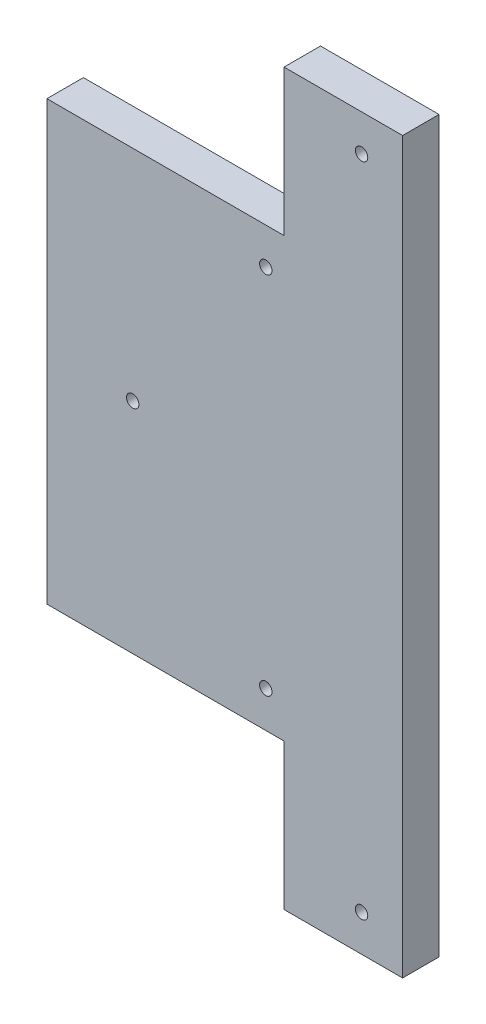
from build123d import *

# Parameters (mm, degrees)
BOSS_EXTRUDE1_DEPTH             = 10
SKETCH4_R                       = 1.7
CUT_EXTRUDE3_DEPTH              = 15
CBORE_FOR_M3_SBHCS1_D           = 3.4
CBORE_FOR_M3_SBHCS1_DEPTH       = 3.15
CBORE_FOR_M3_SBHCS1_CBORE_D     = 6.7
CBORE_FOR_M3_SBHCS1_CBORE_DEPTH = 1.65
CBORE_FOR_M3_SBHCS1_TIP         = 1.021463052
CBORE_FOR_M3_SBHCS2_D           = 3.4
CBORE_FOR_M3_SBHCS2_DEPTH       = 3.15
CBORE_FOR_M3_SBHCS2_CBORE_D     = 6.7
CBORE_FOR_M3_SBHCS2_CBORE_DEPTH = 1.65
CBORE_FOR_M3_SBHCS2_TIP         = 1.021463052
SKETCH7_W                       = 65
SKETCH7_H                       = 120
BOSS_EXTRUDE2_DEPTH             = 10
SKETCH9_W                       = 10
SKETCH9_H                       = 120
BOSS_EXTRUDE3_DEPTH             = 12
SKETCH10_W                      = 65
SKETCH10_H                      = 120
BOSS_EXTRUDE4_DEPTH             = 7
SKETCH11_R                      = 11
BOSS_EXTRUDE5_DEPTH             = 12
SKETCH13_W                      = 65
SKETCH13_H                      = 120
CUT_EXTRUDE4_DEPTH              = 19
SKETCH14_R                      = 1.7
CUT_EXTRUDE5_DEPTH              = 15
CBORE_FOR_M3_SBHCS3_D           = 3.4
CBORE_FOR_M3_SBHCS3_DEPTH       = 3.15
CBORE_FOR_M3_SBHCS3_CBORE_D     = 6.7
CBORE_FOR_M3_SBHCS3_CBORE_DEPTH = 1.65
CBORE_FOR_M3_SBHCS3_TIP         = 1.021463052
SKETCH17_R                      = 1.7
CUT_EXTRUDE6_DEPTH              = 10
CBORE_FOR_M3_SBHCS4_D           = 3.4
CBORE_FOR_M3_SBHCS4_DEPTH       = 3.15
CBORE_FOR_M3_SBHCS4_CBORE_D     = 6.7
CBORE_FOR_M3_SBHCS4_CBORE_DEPTH = 1.65
CBORE_FOR_M3_SBHCS4_TIP         = 1.021463052


with BuildPart() as part:
    # Sketch1 → Boss-Extrude1 (new body)
    with BuildSketch(Plane(origin=(0, 0, 0), x_dir=(0, 1, 0), z_dir=(0, 0, 1))):
        Polygon((-100, 11.25), (-100, 21.25), (100, 21.25), (100, 11.25), (100, -11.25), (-100, -11.25), align=None)
    extrude(amount=BOSS_EXTRUDE1_DEPTH)

    # Sketch4 → Cut-Extrude3 (cut)
    with BuildSketch(Plane.XY.offset(10)):
        with Locations((0, 90)):
            Circle(SKETCH4_R)
        with Locations((0, -90)):
            Circle(SKETCH4_R)
    extrude(amount=-CUT_EXTRUDE3_DEPTH, mode=Mode.SUBTRACT)

    # CBORE for M3 SBHCS1
    with Locations(Plane(origin=(0, 90, 0), x_dir=(-1, 0, 0), z_dir=(0, 0, -1))):
        with Locations((0, 0)):
            CounterBoreHole(CBORE_FOR_M3_SBHCS1_D / 2, CBORE_FOR_M3_SBHCS1_CBORE_D / 2, CBORE_FOR_M3_SBHCS1_CBORE_DEPTH, depth=CBORE_FOR_M3_SBHCS1_DEPTH)
            with Locations((0, 0, -(CBORE_FOR_M3_SBHCS1_DEPTH + CBORE_FOR_M3_SBHCS1_TIP / 2))):  # 118° drill point
                Cone(0, CBORE_FOR_M3_SBHCS1_D / 2, CBORE_FOR_M3_SBHCS1_TIP, mode=Mode.SUBTRACT)

    # CBORE for M3 SBHCS2
    with Locations(Plane(origin=(0, -90, 0), x_dir=(-1, 0, 0), z_dir=(0, 0, -1))):
        with Locations((0, 0)):
            CounterBoreHole(CBORE_FOR_M3_SBHCS2_D / 2, CBORE_FOR_M3_SBHCS2_CBORE_D / 2, CBORE_FOR_M3_SBHCS2_CBORE_DEPTH, depth=CBORE_FOR_M3_SBHCS2_DEPTH)
            with Locations((0, 0, -(CBORE_FOR_M3_SBHCS2_DEPTH + CBORE_FOR_M3_SBHCS2_TIP / 2))):  # 118° drill point
                Cone(0, CBORE_FOR_M3_SBHCS2_D / 2, CBORE_FOR_M3_SBHCS2_TIP, mode=Mode.SUBTRACT)

    # Sketch7 → Boss-Extrude2 (add)
    with BuildSketch(Plane(origin=(0, 0, 0), x_dir=(1, 0, 0), z_dir=(0, 0, -1))):
        with Locations((-53.75, 0)):
            Rectangle(SKETCH7_W, SKETCH7_H)
    extrude(amount=-BOSS_EXTRUDE2_DEPTH)

    # Sketch9 → Boss-Extrude3 (add)
    with BuildSketch(Plane.XY.offset(10)):
        with Locations((-26.25, 0)):
            Rectangle(SKETCH9_W, SKETCH9_H)
    extrude(amount=BOSS_EXTRUDE3_DEPTH)

    # Sketch10 → Boss-Extrude4 (add)
    with BuildSketch(Plane.XY.offset(22)):
        with Locations((-53.75, 0)):
            Rectangle(SKETCH10_W, SKETCH10_H)
    extrude(amount=BOSS_EXTRUDE4_DEPTH)

    # Sketch11 → Boss-Extrude5 (add)
    with BuildSketch(Plane(origin=(0, 0, 22), x_dir=(1, 0, 0), z_dir=(0, 0, -1))):
        with Locations((-62.74, 0)):
            Circle(SKETCH11_R)
    extrude(amount=BOSS_EXTRUDE5_DEPTH)

    # Sketch13 → Cut-Extrude4 (cut)
    with BuildSketch(Plane.XY.offset(29)):
        with Locations((-53.75, 0)):
            Rectangle(SKETCH13_W, SKETCH13_H)
    extrude(amount=-CUT_EXTRUDE4_DEPTH, mode=Mode.SUBTRACT)

    # Sketch14 → Cut-Extrude5 (cut)
    with BuildSketch(Plane(origin=(0, 0, 0), x_dir=(1, 0, 0), z_dir=(0, 0, -1))):
        with Locations((-26.25, 50)):
            Circle(SKETCH14_R)
        with Locations((-26.25, -50)):
            Circle(SKETCH14_R)
    extrude(amount=-CUT_EXTRUDE5_DEPTH, mode=Mode.SUBTRACT)

    # CBORE for M3 SBHCS3
    with Locations(Plane(origin=(-26.25, -50, 0), x_dir=(-1, 0, 0), z_dir=(0, 0, -1))):
        with Locations((0, 0), (0, 100)):
            CounterBoreHole(CBORE_FOR_M3_SBHCS3_D / 2, CBORE_FOR_M3_SBHCS3_CBORE_D / 2, CBORE_FOR_M3_SBHCS3_CBORE_DEPTH, depth=CBORE_FOR_M3_SBHCS3_DEPTH)
            with Locations((0, 0, -(CBORE_FOR_M3_SBHCS3_DEPTH + CBORE_FOR_M3_SBHCS3_TIP / 2))):  # 118° drill point
                Cone(0, CBORE_FOR_M3_SBHCS3_D / 2, CBORE_FOR_M3_SBHCS3_TIP, mode=Mode.SUBTRACT)

    # Sketch17 → Cut-Extrude6 (cut)
    with BuildSketch(Plane(origin=(0, 0, 0), x_dir=(1, 0, 0), z_dir=(0, 0, -1))):
        with Locations((-62.74, 0)):
            Circle(SKETCH17_R)
    extrude(amount=-CUT_EXTRUDE6_DEPTH, mode=Mode.SUBTRACT)

    # CBORE for M3 SBHCS4
    with Locations(Plane(origin=(-62.74, 0, 0), x_dir=(-1, 0, 0), z_dir=(0, 0, -1))):
        with Locations((0, 0)):
            CounterBoreHole(CBORE_FOR_M3_SBHCS4_D / 2, CBORE_FOR_M3_SBHCS4_CBORE_D / 2, CBORE_FOR_M3_SBHCS4_CBORE_DEPTH, depth=CBORE_FOR_M3_SBHCS4_DEPTH)
            with Locations((0, 0, -(CBORE_FOR_M3_SBHCS4_DEPTH + CBORE_FOR_M3_SBHCS4_TIP / 2))):  # 118° drill point
                Cone(0, CBORE_FOR_M3_SBHCS4_D / 2, CBORE_FOR_M3_SBHCS4_TIP, mode=Mode.SUBTRACT)


solid = part.part
